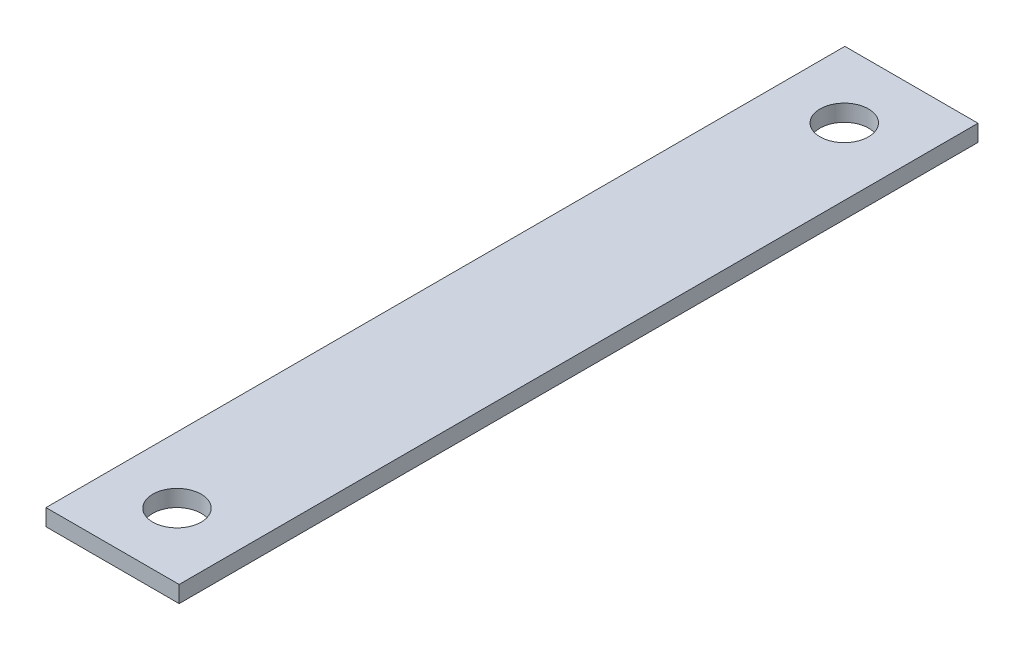
from build123d import *

# Parameters (mm, degrees)
SKETCH1_W           = 12.7
SKETCH1_H           = 76.2
SKETCH1_R           = 2.31
BOSS_EXTRUDE1_DEPTH = 1.5875


with BuildPart() as part:
    # Sketch1 → Boss-Extrude1 (new body)
    with BuildSketch(Plane(origin=(0, 0, 0), x_dir=(1, 0, 0), z_dir=(0, 1, 0))):
        with Locations((6.35, 63.437542426)):
            Rectangle(SKETCH1_W, SKETCH1_H)
        with Locations(Location((6.293214881, 95.187542426, 0), (0, 0, 270))):
            Circle(SKETCH1_R, mode=Mode.SUBTRACT)
        with Locations(Location((6.293214881, 31.537542426, 0), (0, 0, 270))):
            Circle(SKETCH1_R, mode=Mode.SUBTRACT)
    extrude(amount=BOSS_EXTRUDE1_DEPTH)


solid = part.part
